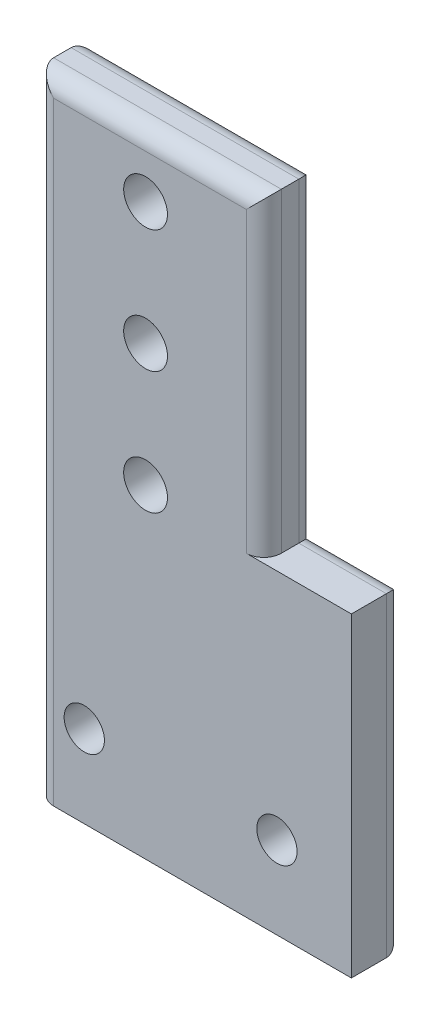
from build123d import *

# Parameters (mm, degrees)
SKETCH1_R           = 1.25
SKETCH1_R_2         = 1.15
BOSS_EXTRUDE1_DEPTH = 3
FILLET2_R           = 1


with BuildPart() as part:
    # Sketch1 → Boss-Extrude1 (new body)
    with BuildSketch(Plane.XY):
        Polygon((-27.25, 21), (-27.25, 0), (-27.25, -15), (-9.25, -15), (-9.25, 3), (-14.25, 3), (-14.25, 21), align=None)
        with Locations((-21, 17.5)):
            Circle(SKETCH1_R, mode=Mode.SUBTRACT)
        with Locations((-21, 10.5)):
            Circle(SKETCH1_R, mode=Mode.SUBTRACT)
        with Locations((-21, 3.5)):
            Circle(SKETCH1_R, mode=Mode.SUBTRACT)
        with Locations((-13.5, -10.3)):
            Circle(SKETCH1_R_2, mode=Mode.SUBTRACT)
        with Locations((-24.5, -10.3)):
            Circle(SKETCH1_R_2, mode=Mode.SUBTRACT)
    extrude(amount=BOSS_EXTRUDE1_DEPTH)

    # Fillet2
    fillet2_edges = [part.edges().sort_by_distance(p)[0] for p in [
        (-20.75, 21, 0),
        (-14.25, 12, 3),
        (-20.75, 21, 3),
        (-14.25, 12, 0),
        (-11.75, 3, 0),
        (-9.25, -6, 0),
        (-18.25, -15, 0),
        (-27.25, 3, 3),
        (-27.25, 3, 0),
    ]]
    fillet(fillet2_edges, radius=FILLET2_R)


solid = part.part
